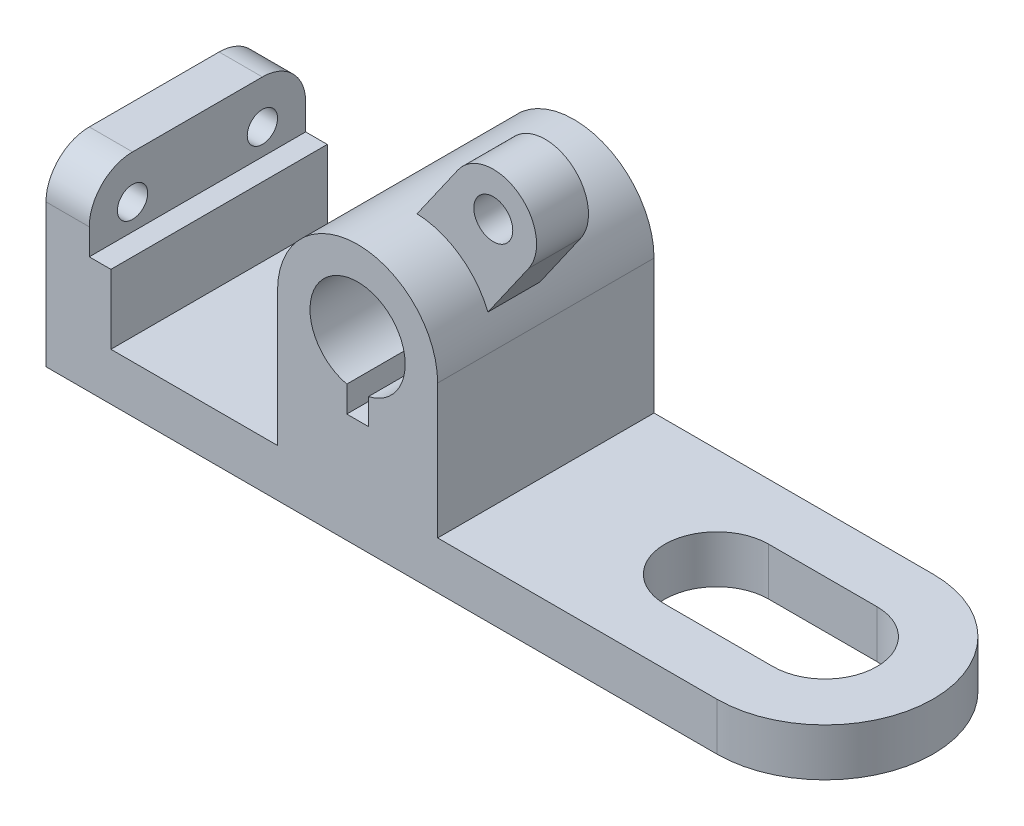
from build123d import *

# Parameters (mm, degrees)
BOSS_EXTRUDE1_DEPTH = 25
SKETCH1_3_R         = 4.5
BOSS_EXTRUDE2_DEPTH = 12
CUT_EXTRUDE1_REACH  = 131.64
CUT_EXTRUDE2_REACH  = 199.844
SKETCH3_R           = 3.5


with BuildPart() as part:
    # Sketch1 → Boss-Extrude1 (new, symmetric)
    with BuildSketch(Plane.XY):
        with BuildLine():
            Line((-72, 43), (-72, 0))
            Line((-72, 0), (108, 0))
            Line((108, 0), (108, 11))
            Line((108, 11), (18.5, 11))
            Line((18.5, 11), (18.5, 42))
            ThreePointArc((18.5, 42), (18.151437184, 45.574259105), (17.118883443, 49.013831311))
            ThreePointArc((17.118883443, 49.013831311), (10.611164072, 57.154312819), (0.735842557, 60.485360038))
            ThreePointArc((0.735842557, 60.485360038), (-12.818676076, 55.339098307), (-18.5, 42))
            Line((-18.5, 42), (-18.5, 11))
            Line((-18.5, 11), (-57, 11))
            Line((-57, 11), (-57, 27))
            Line((-57, 27), (-62, 27))
            Line((-62, 27), (-62, 43))
            Line((-62, 43), (-72, 43))
        make_face()
        with BuildLine():
            Line((-2.5, 25.287857357), (-2.5, 31.287857357))
            ThreePointArc((-2.5, 31.287857357), (0, 53), (2.5, 31.287857357))
            Line((2.5, 31.287857357), (2.5, 25.287857357))
            Line((2.5, 25.287857357), (-2.5, 25.287857357))
        make_face(mode=Mode.SUBTRACT)
    extrude(amount=BOSS_EXTRUDE1_DEPTH, both=True)

    # Sketch1<3> → Boss-Extrude2 (add)
    with BuildSketch(Plane.XY):
        with BuildLine():
            ThreePointArc((0.735842557, 60.485360038), (10.611164072, 57.154312819), (17.118883443, 49.013831311))
            Line((17.118883443, 49.013831311), (26.545966406, 62.477101054))
            ThreePointArc((26.545966406, 62.477101054), (24.090210327, 76.40438586), (10.16292552, 73.948629781))
            Line((10.16292552, 73.948629781), (0.735842557, 60.485360038))
        make_face()
        with Locations((18.354445963, 68.212865417)):
            Circle(SKETCH1_3_R, mode=Mode.SUBTRACT)
    extrude(amount=BOSS_EXTRUDE2_DEPTH)

    # Sketch2 → Cut-Extrude1 (cut, up to next)
    with BuildSketch(Plane(origin=(0, 11, 0), x_dir=(1, 0, 0), z_dir=(0, 1, 0)), mode=Mode.PRIVATE) as cut_extrude1_sk1:
        with BuildLine():
            Line((83, 12), (58, 12))
            ThreePointArc((58, 12), (46, 0), (58, -12))
            Line((58, -12), (83, -12))
            ThreePointArc((83, -12), (95, 0), (83, 12))
        make_face()
    cut_extrude1_tool1 = extrude(cut_extrude1_sk1.sketch, amount=-CUT_EXTRUDE1_REACH, mode=Mode.PRIVATE) & part.part
    # Sketch2 → Cut-Extrude1 (cut, up to next)
    with BuildSketch(Plane(origin=(0, 11, 0), x_dir=(1, 0, 0), z_dir=(0, 1, 0)), mode=Mode.PRIVATE) as cut_extrude1_sk2:
        with BuildLine():
            ThreePointArc((83, 25), (100.677669542, 17.677669518), (108, -3.4e-08))
            Line((108, -3.4e-08), (108, 25))
            Line((108, 25), (83, 25))
        make_face()
    cut_extrude1_tool2 = extrude(cut_extrude1_sk2.sketch, amount=-CUT_EXTRUDE1_REACH, mode=Mode.PRIVATE) & part.part
    # Sketch2 → Cut-Extrude1 (cut, up to next)
    with BuildSketch(Plane(origin=(0, 11, 0), x_dir=(1, 0, 0), z_dir=(0, 1, 0)), mode=Mode.PRIVATE) as cut_extrude1_sk3:
        with BuildLine():
            ThreePointArc((108, -3.4e-08), (100.677669518, -17.677669542), (83, -25))
            Line((83, -25), (108, -25))
            Line((108, -25), (108, -3.4e-08))
        make_face()
    cut_extrude1_tool3 = extrude(cut_extrude1_sk3.sketch, amount=-CUT_EXTRUDE1_REACH, mode=Mode.PRIVATE) & part.part
    add(cut_extrude1_tool1.solids().sort_by_distance((70.5, 11, 0))[0], mode=Mode.SUBTRACT)
    add(cut_extrude1_tool2.solids().sort_by_distance((102.415802, 11, -19.415802))[0], mode=Mode.SUBTRACT)
    add(cut_extrude1_tool3.solids().sort_by_distance((102.415802, 11, 19.415802))[0], mode=Mode.SUBTRACT)

    # Sketch3 → Cut-Extrude2 (cut, up to next)
    with BuildSketch(Plane.ZY.offset(72), mode=Mode.PRIVATE) as cut_extrude2_sk1:
        with BuildLine():
            ThreePointArc((-25, 33), (-22.071067778, 40.071067846), (-14.999999905, 43))
            Line((-14.999999905, 43), (-25, 43))
            Line((-25, 43), (-25, 33))
        make_face()
    cut_extrude2_tool1 = extrude(cut_extrude2_sk1.sketch, amount=-CUT_EXTRUDE2_REACH, mode=Mode.PRIVATE) & part.part
    # Sketch3 → Cut-Extrude2 (cut, up to next)
    with BuildSketch(Plane.ZY.offset(72), mode=Mode.PRIVATE) as cut_extrude2_sk2:
        with BuildLine():
            ThreePointArc((15, 43), (22.071067812, 40.071067812), (25, 33))
            Line((25, 33), (25, 43))
            Line((25, 43), (15, 43))
        make_face()
    cut_extrude2_tool2 = extrude(cut_extrude2_sk2.sketch, amount=-CUT_EXTRUDE2_REACH, mode=Mode.PRIVATE) & part.part
    # Sketch3 → Cut-Extrude2 (cut, up to next)
    with BuildSketch(Plane.ZY.offset(72), mode=Mode.PRIVATE) as cut_extrude2_sk3:
        with Locations((15, 33)):
            Circle(SKETCH3_R)
    cut_extrude2_tool3 = extrude(cut_extrude2_sk3.sketch, amount=-CUT_EXTRUDE2_REACH, mode=Mode.PRIVATE) & part.part
    # Sketch3 → Cut-Extrude2 (cut, up to next)
    with BuildSketch(Plane.ZY.offset(72), mode=Mode.PRIVATE) as cut_extrude2_sk4:
        with Locations((-15, 33)):
            Circle(SKETCH3_R)
    cut_extrude2_tool4 = extrude(cut_extrude2_sk4.sketch, amount=-CUT_EXTRUDE2_REACH, mode=Mode.PRIVATE) & part.part
    add(cut_extrude2_tool1.solids().sort_by_distance((-72, 40.766321, -22.766321))[0], mode=Mode.SUBTRACT)
    add(cut_extrude2_tool2.solids().sort_by_distance((-72, 40.766321, 22.766321))[0], mode=Mode.SUBTRACT)
    add(cut_extrude2_tool3.solids().sort_by_distance((-72, 33, 15))[0], mode=Mode.SUBTRACT)
    add(cut_extrude2_tool4.solids().sort_by_distance((-72, 33, -15))[0], mode=Mode.SUBTRACT)


solid = part.part
